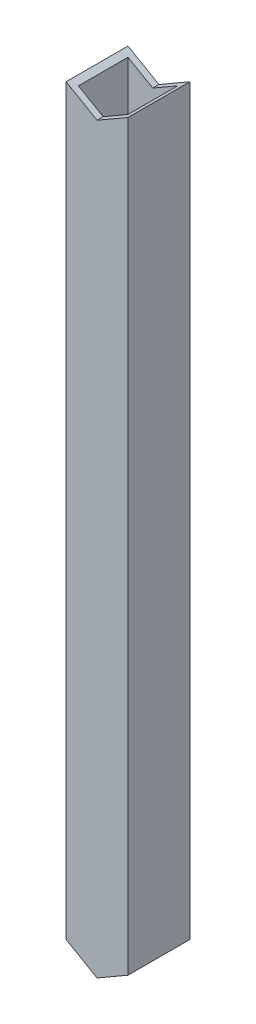
from build123d import *

# Parameters (mm, degrees)
BOSS_EXTRUDE1_DEPTH     = 50
CUT_EXTRUDE2_DEPTH      = 603.59853966
CUT_EXTRUDE2_DEPTH_BACK = 603.59853966
SKETCH3_W               = 40
SKETCH3_H               = 40


with BuildPart() as part:
    # Sketch1 → Boss-Extrude1 (new body)
    with BuildSketch(Plane.XY):
        Polygon((0, 0), (25, 14.43375673), (25, -585.56624327), (0, -600), (-25, -585.56624327), (-25, 14.43375673), align=None)
    extrude(amount=BOSS_EXTRUDE1_DEPTH)

    # Sketch3 → Cut-Extrude2 (cut, two sides: drawn at the far end of the back side and taken through both)
    with BuildSketch(Plane(origin=(0, 0, 0), x_dir=(1, 0, 0), z_dir=(0, 1, 0)).offset(-CUT_EXTRUDE2_DEPTH_BACK)):
        with Locations((0, -25)):
            Rectangle(SKETCH3_W, SKETCH3_H)
    extrude(amount=CUT_EXTRUDE2_DEPTH + CUT_EXTRUDE2_DEPTH_BACK, mode=Mode.SUBTRACT)


solid = part.part
